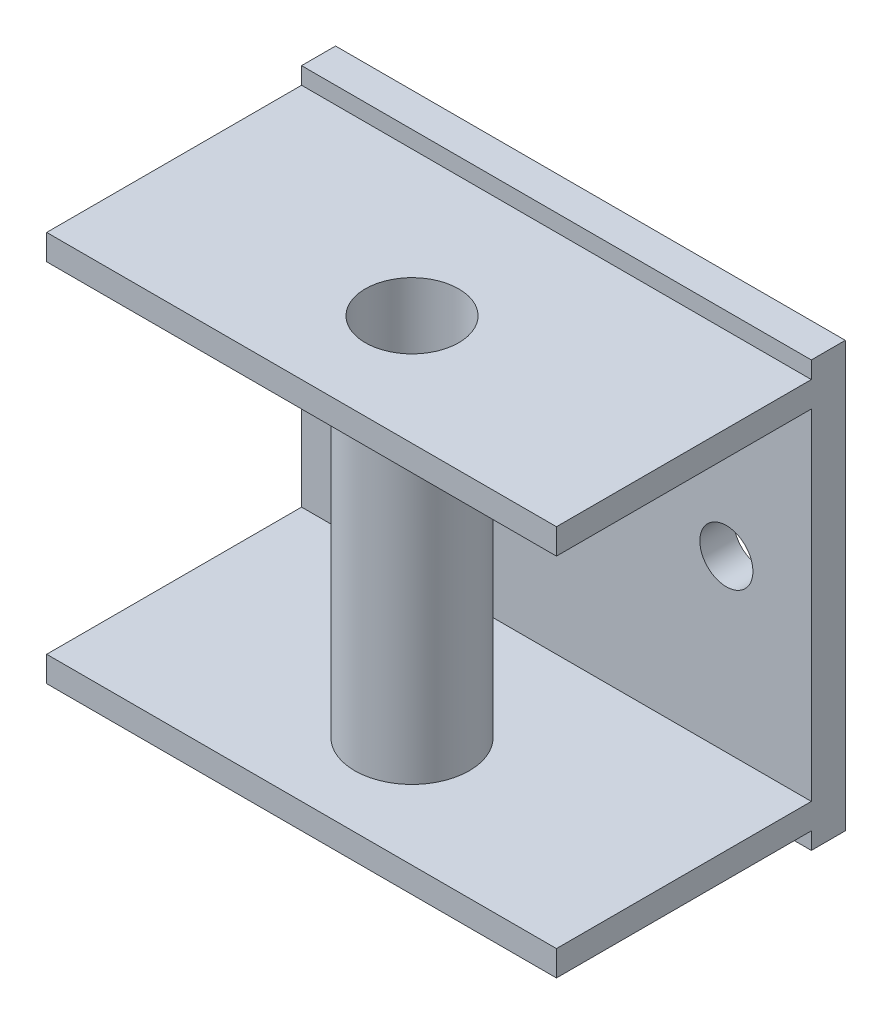
from build123d import *

# Parameters (mm, degrees)
SKETCH_1_W          = 120
SKETCH_1_H          = 100
SKETCH_1_R          = 6.25
EXTRUDE_1_DEPTH     = 8
SKETCH_2_W          = 120
SKETCH_2_H          = 6
EXTRUDE_2_DEPTH     = 60
SKETCH_3_R          = 11
CUT_EXTRUDE_1_DEPTH = 133.060592154
EXTRUDE_3_REACH     = 129.765
SKETCH_4_R          = 13.5
SKETCH_4_R_2        = 11


with BuildPart() as part:
    # Эскиз1 → Бобышка-Вытянуть1 (new body)
    with BuildSketch(Plane.XY):
        Rectangle(SKETCH_1_W, SKETCH_1_H)
        Circle(SKETCH_1_R, mode=Mode.SUBTRACT)
        with Locations((40, 0)):
            Circle(SKETCH_1_R, mode=Mode.SUBTRACT)
        with Locations(Location((-40, 0, 0), (0, 0, 180))):
            Circle(SKETCH_1_R, mode=Mode.SUBTRACT)
    extrude(amount=EXTRUDE_1_DEPTH)

    # Эскиз2 → Бобышка-Вытянуть2 (add)
    with BuildSketch(Plane.XY.offset(8)):
        with Locations((0, -43)):
            Rectangle(SKETCH_2_W, SKETCH_2_H)
        with Locations((0, 43)):
            Rectangle(SKETCH_2_W, SKETCH_2_H)
    extrude(amount=EXTRUDE_2_DEPTH)

    # Эскиз3 → Вырез-Вытянуть1 (cut, through all)
    with BuildSketch(Plane.XZ.offset(46)):
        with Locations(Location((0, 42, 0), (0, 0, 270))):
            Circle(SKETCH_3_R)
    extrude(amount=-CUT_EXTRUDE_1_DEPTH, mode=Mode.SUBTRACT)

    # Эскиз4 → Бобышка-Вытянуть3 (add, up to next)
    with BuildSketch(Plane.XZ.offset(-40), mode=Mode.PRIVATE) as extrude_3_sk1:
        with Locations(Location((0, 42, 0), (0, 0, 90))):
            Circle(SKETCH_4_R)
        with Locations(Location((0, 42, 0), (0, 0, 270))):
            Circle(SKETCH_4_R_2, mode=Mode.SUBTRACT)
    extrude_3_tool1 = extrude(extrude_3_sk1.sketch, amount=EXTRUDE_3_REACH, mode=Mode.PRIVATE) - part.part
    add(extrude_3_tool1.solids().sort_by_distance((0, 40, 28.881838))[0])


solid = part.part
